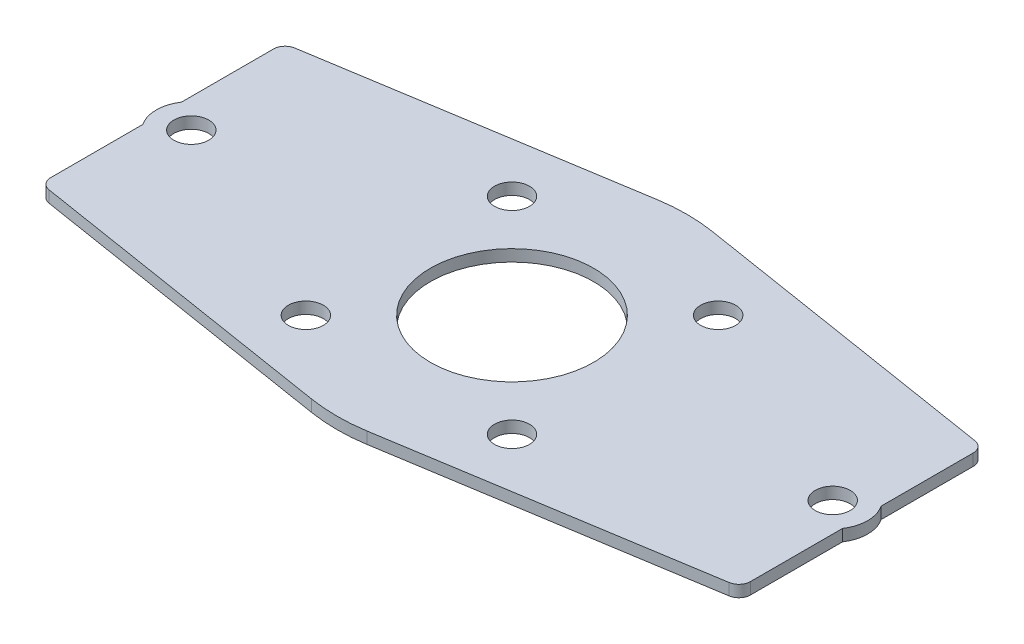
from build123d import *

# Parameters (mm, degrees)
SKETCH1_R           = 1.5
SKETCH1_R_2         = 7
BOSS_EXTRUDE1_DEPTH = 1


with BuildPart() as part:
    # Sketch1 → Boss-Extrude1 (new body)
    with BuildSketch(Plane(origin=(0, 0, 0), x_dir=(1, 0, 0), z_dir=(0, 1, 0))):
        with BuildLine():
            Line((-2.365441422, 14.812315379), (-29.157696095, 10.533746677))
            ThreePointArc((-29.157696095, 10.533746677), (-29.760820641, 10.195221197), (-30, 9.546258985))
            Line((-30, 9.546258985), (-30, 1.658312395))
            ThreePointArc((-30, 1.658312395), (-30.5, 0), (-30, -1.658312395))
            Line((-30, -1.658312395), (-30, -9.546258985))
            ThreePointArc((-30, -9.546258985), (-29.760820641, -10.195221197), (-29.157696095, -10.533746677))
            Line((-29.157696095, -10.533746677), (-2.365441422, -14.812315379))
            ThreePointArc((-2.365441422, -14.812315379), (0, -15), (2.365441422, -14.812315379))
            Line((2.365441422, -14.812315379), (29.157696095, -10.533746677))
            ThreePointArc((29.157696095, -10.533746677), (29.760820641, -10.195221197), (30, -9.546258985))
            Line((30, -9.546258985), (30, -1.658312395))
            ThreePointArc((30, -1.658312395), (30.5, 0), (30, 1.658312395))
            Line((30, 1.658312395), (30, 9.546258985))
            ThreePointArc((30, 9.546258985), (29.760820641, 10.195221197), (29.157696095, 10.533746677))
            Line((29.157696095, 10.533746677), (2.365441422, 14.812315379))
            ThreePointArc((2.365441422, 14.812315379), (0, 15), (-2.365441422, 14.812315379))
        make_face()
        with Locations(Location((8.838834765, 8.838834765, 0), (0, 0, 270))):
            Circle(SKETCH1_R, mode=Mode.SUBTRACT)
        with Locations(Location((-8.838834765, -8.838834765, 0), (0, 0, 270))):
            Circle(SKETCH1_R, mode=Mode.SUBTRACT)
        with Locations(Location((8.838834765, -8.838834765, 0), (0, 0, 270))):
            Circle(SKETCH1_R, mode=Mode.SUBTRACT)
        with Locations(Location((0, 0, 0), (0, 0, 270))):
            Circle(SKETCH1_R_2, mode=Mode.SUBTRACT)
        with Locations(Location((-8.838834765, 8.838834765, 0), (0, 0, 270))):
            Circle(SKETCH1_R, mode=Mode.SUBTRACT)
        with Locations(Location((-27.5, 0, 0), (0, 0, 270))):
            Circle(SKETCH1_R, mode=Mode.SUBTRACT)
        with Locations(Location((27.5, 0, 0), (0, 0, 270))):
            Circle(SKETCH1_R, mode=Mode.SUBTRACT)
    extrude(amount=BOSS_EXTRUDE1_DEPTH)


solid = part.part
